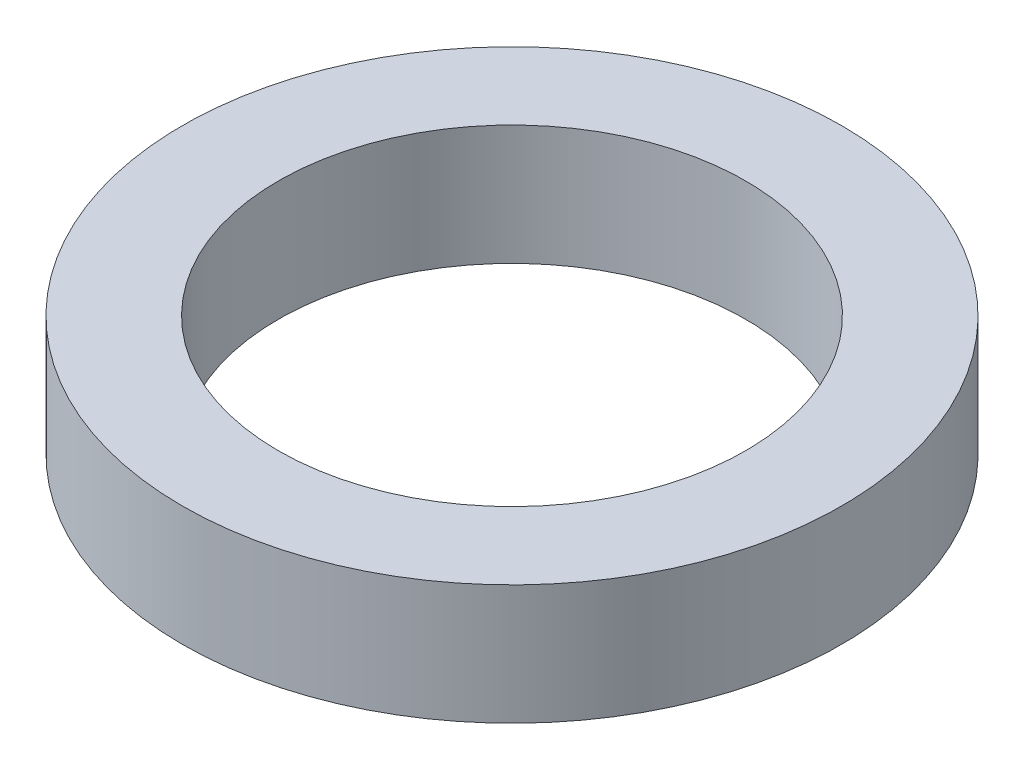
from build123d import *

# Parameters (mm, degrees)
SKETCH1_R           = 2.794
SKETCH1_R_2         = 1.9812
BOSS_EXTRUDE1_DEPTH = 1.016


with BuildPart() as part:
    # Sketch1 → Boss-Extrude1 (new body)
    with BuildSketch(Plane(origin=(0, 0, 0), x_dir=(1, 0, 0), z_dir=(0, 1, 0))):
        with Locations(Location((0, 0, 0), (0, 0, 270))):
            Circle(SKETCH1_R)
        with Locations(Location((0, 0, 0), (0, 0, 270))):
            Circle(SKETCH1_R_2, mode=Mode.SUBTRACT)
    extrude(amount=BOSS_EXTRUDE1_DEPTH)


solid = part.part
